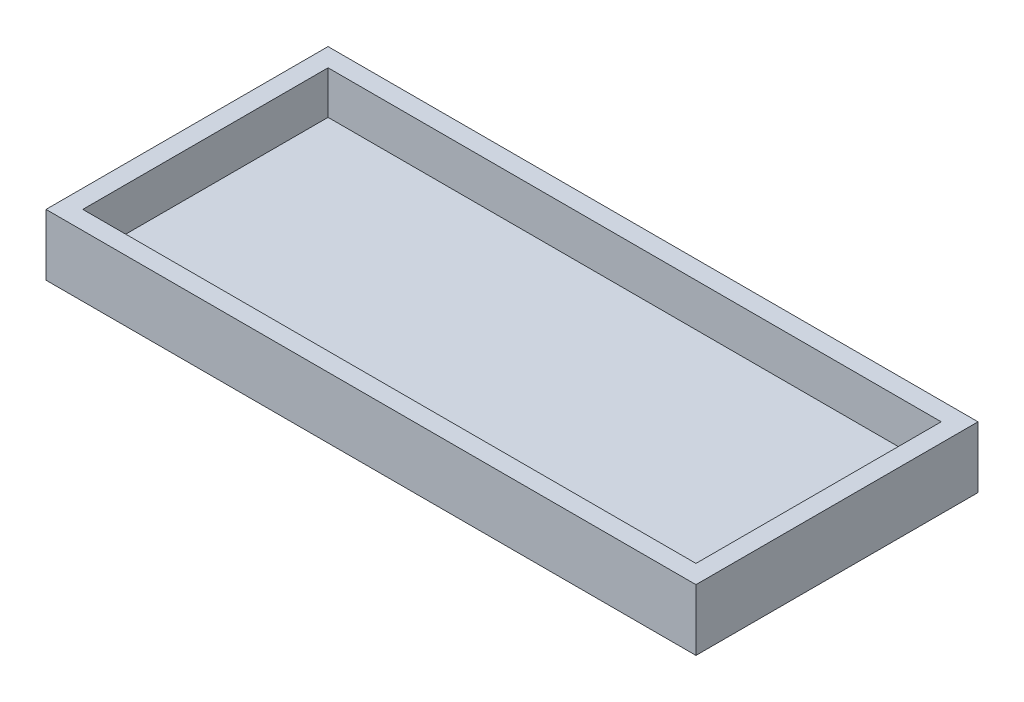
from build123d import *

# Parameters (mm, degrees)
SKETCH1_W           = 106
SKETCH1_H           = 46
BOSS_EXTRUDE1_DEPTH = 10
SKETCH2_W           = 100
SKETCH2_H           = 40
CUT_EXTRUDE1_DEPTH  = 7


with BuildPart() as part:
    # Sketch1 → Boss-Extrude1 (new body)
    with BuildSketch(Plane(origin=(0, 0, 0), x_dir=(1, 0, 0), z_dir=(0, 1, 0))):
        Rectangle(SKETCH1_W, SKETCH1_H)
    extrude(amount=BOSS_EXTRUDE1_DEPTH)

    # Sketch2 → Cut-Extrude1 (cut)
    with BuildSketch(Plane(origin=(0, 10, 0), x_dir=(1, 0, 0), z_dir=(0, 1, 0))):
        Rectangle(SKETCH2_W, SKETCH2_H)
    extrude(amount=-CUT_EXTRUDE1_DEPTH, mode=Mode.SUBTRACT)


solid = part.part
